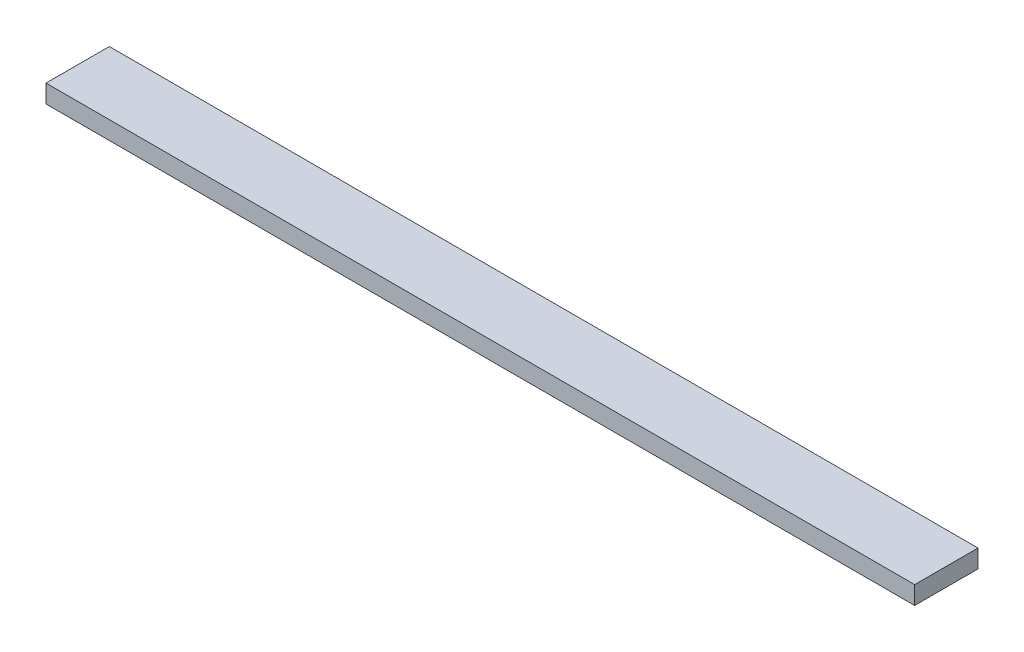
from build123d import *

# Parameters (mm, degrees)
SKETCH1_W           = 304.8
SKETCH1_H           = 22.225
BOSS_EXTRUDE1_DEPTH = 6.35


with BuildPart() as part:
    # Sketch1 → Boss-Extrude1 (new body)
    with BuildSketch(Plane(origin=(0, 0, 0), x_dir=(1, 0, 0), z_dir=(0, 1, 0))):
        Rectangle(SKETCH1_W, SKETCH1_H)
    extrude(amount=BOSS_EXTRUDE1_DEPTH)


solid = part.part
